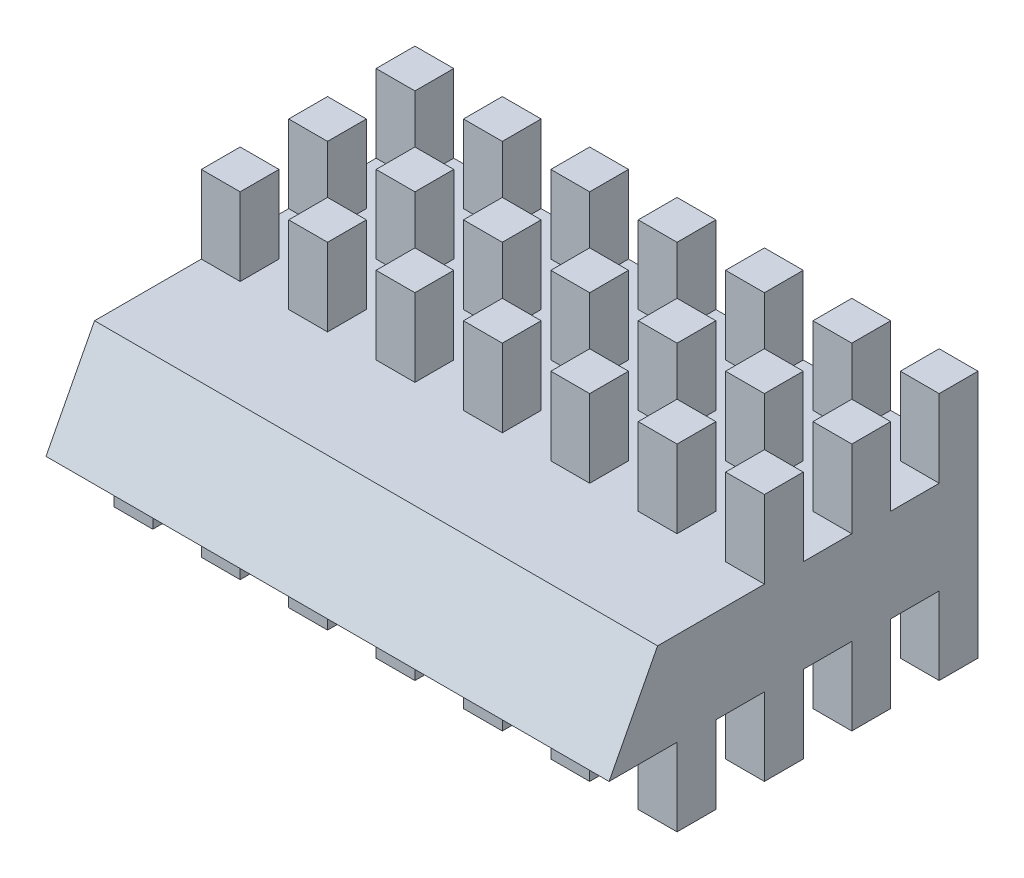
from build123d import *

# Parameters (mm, degrees)
SKETCH1_W           = 18.415
SKETCH1_H           = 17.78
BOSS_EXTRUDE1_DEPTH = 1.524
SKETCH2_W           = 1.27
SKETCH2_H           = 1.27
BOSS_EXTRUDE3_DEPTH = 2.54
SKETCH3_W           = 1.27
SKETCH3_H           = 2.54
CUT_EXTRUDE1_DEPTH  = 26.918270023
SKETCH4_W           = 5.715
SKETCH4_H           = 8.128
CUT_EXTRUDE2_DEPTH  = 26.918270023


with BuildPart() as part:
    # Sketch1 → Boss-Extrude1 (new body)
    with BuildSketch(Plane(origin=(0, 0, 0), x_dir=(1, 0, 0), z_dir=(0, 1, 0))):
        with Locations((9.2075, 8.89)):
            Rectangle(SKETCH1_W, SKETCH1_H)
    boss_extrude1 = extrude(amount=BOSS_EXTRUDE1_DEPTH)

    # Sketch2 → Boss-Extrude3 (add)
    with BuildSketch(Plane(origin=(0, 1.524, 0), x_dir=(1, 0, 0), z_dir=(0, 1, 0))):
        with Locations((3.4925, 17.145)):
            Rectangle(SKETCH2_W, SKETCH2_H)
        with Locations((0.635, 17.145)):
            Rectangle(SKETCH2_W, SKETCH2_H)
        with Locations((6.35, 17.145)):
            Rectangle(SKETCH2_W, SKETCH2_H)
        with Locations((9.2075, 17.145)):
            Rectangle(SKETCH2_W, SKETCH2_H)
        with Locations((12.065, 17.145)):
            Rectangle(SKETCH2_W, SKETCH2_H)
        with Locations((14.9225, 17.145)):
            Rectangle(SKETCH2_W, SKETCH2_H)
        with Locations((17.78, 17.145)):
            Rectangle(SKETCH2_W, SKETCH2_H)
        with Locations((3.4925, 14.2875)):
            Rectangle(SKETCH2_W, SKETCH2_H)
        with Locations((6.35, 14.2875)):
            Rectangle(SKETCH2_W, SKETCH2_H)
        with Locations((9.2075, 14.2875)):
            Rectangle(SKETCH2_W, SKETCH2_H)
        with Locations((12.065, 14.2875)):
            Rectangle(SKETCH2_W, SKETCH2_H)
        with Locations((14.9225, 14.2875)):
            Rectangle(SKETCH2_W, SKETCH2_H)
        with Locations((17.78, 14.2875)):
            Rectangle(SKETCH2_W, SKETCH2_H)
        with Locations((3.4925, 11.43)):
            Rectangle(SKETCH2_W, SKETCH2_H)
        with Locations((6.35, 11.43)):
            Rectangle(SKETCH2_W, SKETCH2_H)
        with Locations((9.2075, 11.43)):
            Rectangle(SKETCH2_W, SKETCH2_H)
        with Locations((12.065, 11.43)):
            Rectangle(SKETCH2_W, SKETCH2_H)
        with Locations((14.9225, 11.43)):
            Rectangle(SKETCH2_W, SKETCH2_H)
        with Locations((17.78, 11.43)):
            Rectangle(SKETCH2_W, SKETCH2_H)
        with Locations((3.4925, 8.5725)):
            Rectangle(SKETCH2_W, SKETCH2_H)
        with Locations((6.35, 8.5725)):
            Rectangle(SKETCH2_W, SKETCH2_H)
        with Locations((9.2075, 8.5725)):
            Rectangle(SKETCH2_W, SKETCH2_H)
        with Locations((12.065, 8.5725)):
            Rectangle(SKETCH2_W, SKETCH2_H)
        with Locations((14.9225, 8.5725)):
            Rectangle(SKETCH2_W, SKETCH2_H)
        with Locations((17.78, 8.5725)):
            Rectangle(SKETCH2_W, SKETCH2_H)
        with Locations((3.4925, 5.715)):
            Rectangle(SKETCH2_W, SKETCH2_H)
        with Locations((6.35, 5.715)):
            Rectangle(SKETCH2_W, SKETCH2_H)
        with Locations((9.2075, 5.715)):
            Rectangle(SKETCH2_W, SKETCH2_H)
        with Locations((12.065, 5.715)):
            Rectangle(SKETCH2_W, SKETCH2_H)
        with Locations((14.9225, 5.715)):
            Rectangle(SKETCH2_W, SKETCH2_H)
        with Locations((17.78, 5.715)):
            Rectangle(SKETCH2_W, SKETCH2_H)
        with Locations((3.4925, 2.8575)):
            Rectangle(SKETCH2_W, SKETCH2_H)
        with Locations((6.35, 2.8575)):
            Rectangle(SKETCH2_W, SKETCH2_H)
        with Locations((9.2075, 2.8575)):
            Rectangle(SKETCH2_W, SKETCH2_H)
        with Locations((12.065, 2.8575)):
            Rectangle(SKETCH2_W, SKETCH2_H)
        with Locations((14.9225, 2.8575)):
            Rectangle(SKETCH2_W, SKETCH2_H)
        with Locations((17.78, 2.8575)):
            Rectangle(SKETCH2_W, SKETCH2_H)
        with Locations((0.635, 14.2875)):
            Rectangle(SKETCH2_W, SKETCH2_H)
        with Locations((0.635, 11.43)):
            Rectangle(SKETCH2_W, SKETCH2_H)
        with Locations((0.635, 8.5725)):
            Rectangle(SKETCH2_W, SKETCH2_H)
        with Locations((0.635, 5.715)):
            Rectangle(SKETCH2_W, SKETCH2_H)
        with Locations((0.635, 2.8575)):
            Rectangle(SKETCH2_W, SKETCH2_H)
    boss_extrude3 = extrude(amount=BOSS_EXTRUDE3_DEPTH)

    # Mirror1: Boss-Extrude1, Boss-Extrude3 across plane
    add(boss_extrude1.mirror(Plane(origin=(0, 0, 0), x_dir=(0, 0, 1), z_dir=(0, -1, 0))))
    add(boss_extrude3.mirror(Plane(origin=(0, 0, 0), x_dir=(0, 0, 1), z_dir=(0, -1, 0))))

    # Sketch3 → Cut-Extrude1 (cut, through all)
    with BuildSketch(Plane(origin=(18.415, 0, 0), x_dir=(0, 0, -1), z_dir=(1, 0, 0))):
        Polygon((0, -1.524), (1.58668837, 1.524), (0, 1.524), align=None)
        with Locations((2.8575, 2.794)):
            Rectangle(SKETCH3_W, SKETCH3_H)
    extrude(amount=-CUT_EXTRUDE1_DEPTH, mode=Mode.SUBTRACT)

    # Sketch4 → Cut-Extrude2 (cut, through all)
    with BuildSketch(Plane(origin=(18.415, 0, 0), x_dir=(0, 0, -1), z_dir=(1, 0, 0))):
        with Locations((14.9225, 0)):
            Rectangle(SKETCH4_W, SKETCH4_H)
    extrude(amount=-CUT_EXTRUDE2_DEPTH, mode=Mode.SUBTRACT)


solid = part.part
